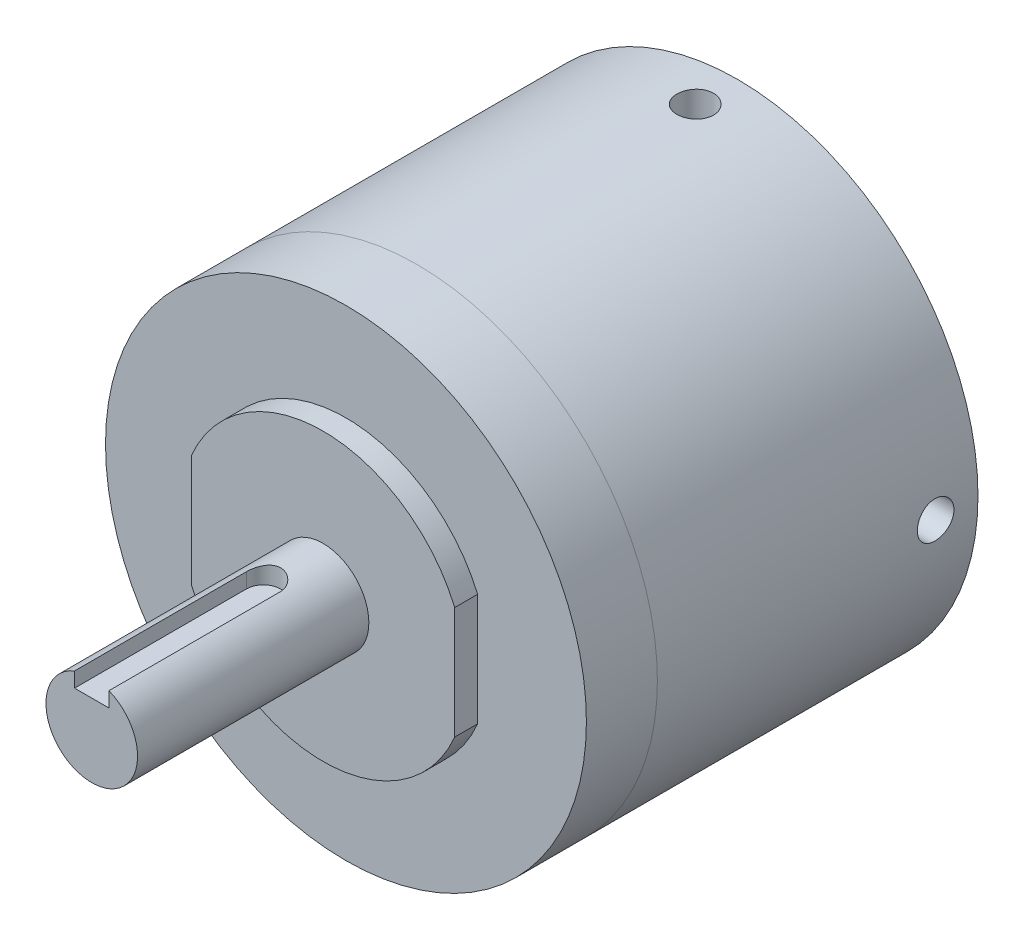
from build123d import *

# Parameters (mm, degrees)
SKETCH_1_R               = 21
SKETCH_1_R_2             = 17.75
EXTRUDE_1_DEPTH          = 34.2
EXTRUDE_START            = -12.2
SKETCH_2_R               = 21
EXTRUDE_2_DEPTH          = 12.2
EXTRUDE_3_DEPTH          = 2
SKETCH_4_R               = 4
EXTRUDE_4_DEPTH          = 20.2
SKETCH_5_R               = 1.6
CUT_EXTRUDE_1_DEPTH      = 64.741352355
PATTERN_CIRCULAR_1_COUNT = 4
CUT_EXTRUDE_2_DEPTH      = 1.6


with BuildPart() as part:
    # ｽｹｯﾁ1 → ﾎﾞｽ - 押し出し1 (new body)
    with BuildSketch(Plane.XY):
        Circle(SKETCH_1_R)
        Circle(SKETCH_1_R_2, mode=Mode.SUBTRACT)
    extrude(amount=EXTRUDE_1_DEPTH)

    # ｽｹｯﾁ2 → ﾎﾞｽ - 押し出し2 (add)
    with BuildSketch(Plane.XY.offset(34.2).offset(EXTRUDE_START)):
        Circle(SKETCH_2_R)
    extrude(amount=EXTRUDE_2_DEPTH)

    # ｽｹｯﾁ3 → ﾎﾞｽ - 押し出し3 (add)
    with BuildSketch(Plane.XY.offset(34.2)):
        with BuildLine():
            Line((-11.5, -4.898979486), (-11.5, 4.898979486))
            ThreePointArc((-11.5, 4.898979486), (0, 12.5), (11.5, 4.898979486))
            Line((11.5, 4.898979486), (11.5, -4.898979486))
            ThreePointArc((11.5, -4.898979486), (0, -12.5), (-11.5, -4.898979486))
        make_face()
    extrude(amount=EXTRUDE_3_DEPTH)

    # ｽｹｯﾁ4 → ﾎﾞｽ - 押し出し4 (add)
    with BuildSketch(Plane.XY.offset(36.2)):
        Circle(SKETCH_4_R)
    extrude(amount=EXTRUDE_4_DEPTH)

    # ｽｹｯﾁ5 → ｶｯﾄ - 押し出し1 (cut, through all)
    with BuildSketch(Plane(origin=(0, 0, 0), x_dir=(1, 0, 0), z_dir=(0, 1, 0))):
        with Locations(Location((0, -3.7, 0), (0, 0, 270))):
            Circle(SKETCH_5_R)
    cut_extrude_1 = extrude(amount=-CUT_EXTRUDE_1_DEPTH, mode=Mode.SUBTRACT)

    # 円形ﾊﾟﾀｰﾝ1: ｶｯﾄ - 押し出し1 ×4 about axis
    pattern_circular_1_axis = Axis((0, 0, 34.2), (0, 0, -1))
    for i in range(1, PATTERN_CIRCULAR_1_COUNT):
        add(cut_extrude_1.rotate(pattern_circular_1_axis, i * 360 / PATTERN_CIRCULAR_1_COUNT), mode=Mode.SUBTRACT)

    # ｽｹｯﾁ7 → ｶｯﾄ - 押し出し2 (cut)
    with BuildSketch(Plane(origin=(0, 4, 0), x_dir=(1, 0, 0), z_dir=(0, 1, 0))):
        with BuildLine():
            Line((-1.5, -56.4), (-1.5, -41.4))
            ThreePointArc((-1.5, -41.4), (0, -39.9), (1.5, -41.4))
            Line((1.5, -41.4), (1.5, -56.4))
            ThreePointArc((1.5, -56.4), (0, -57.9), (-1.5, -56.4))
        make_face()
    extrude(amount=-CUT_EXTRUDE_2_DEPTH, mode=Mode.SUBTRACT)


solid = part.part
